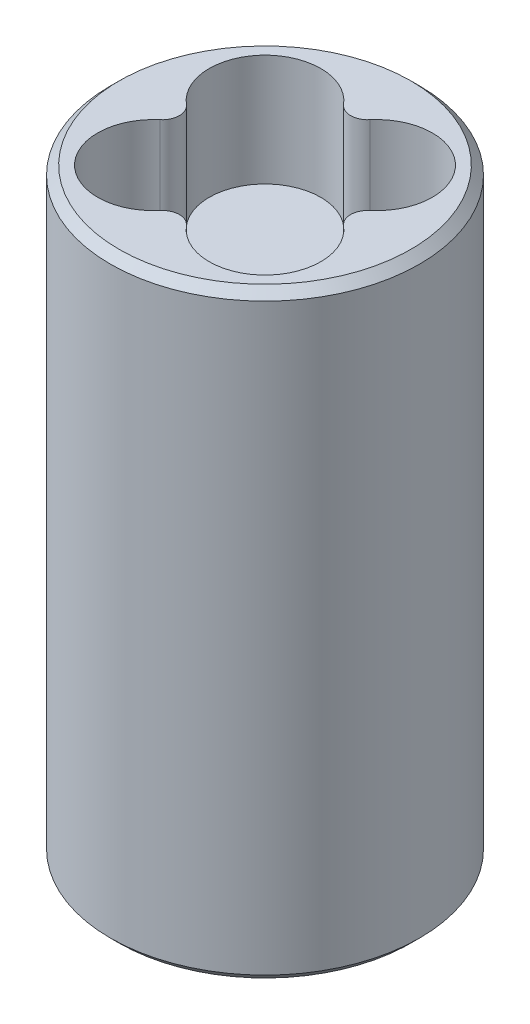
from build123d import *

# Parameters (mm, degrees)
SKETCH3_R           = 9
BOSS_EXTRUDE3_DEPTH = 35
CUT_EXTRUDE1_DEPTH  = 6.5
FILLET1_R           = 1
SKETCH1_R           = 3.05
CUT_EXTRUDE2_DEPTH  = 7
CHAMFER1_SIZE       = 3.05
CHAMFER2_SIZE       = 0.5


with BuildPart() as part:
    # Sketch3 → Boss-Extrude3 (new body)
    with BuildSketch(Plane(origin=(0, 0, 0), x_dir=(1, 0, 0), z_dir=(0, 1, 0))):
        with Locations(Location((0, 0, 0), (0, 0, 270))):
            Circle(SKETCH3_R)
    extrude(amount=BOSS_EXTRUDE3_DEPTH)

    # Sketch4 → Cut-Extrude1 (cut)
    with BuildSketch(Plane(origin=(0, 35, 0), x_dir=(1, 0, 0), z_dir=(0, 1, 0))):
        with BuildLine():
            ThreePointArc((0, -3.25), (5.548097039, -5.548097039), (3.25, 0))
            ThreePointArc((3.25, 0), (5.548097039, 5.548097039), (0, 3.25))
            ThreePointArc((0, 3.25), (-5.548097039, 5.548097039), (-3.25, 0))
            ThreePointArc((-3.25, 0), (-5.548097039, -5.548097039), (0, -3.25))
        make_face()
    extrude(amount=-CUT_EXTRUDE1_DEPTH, mode=Mode.SUBTRACT)

    # Fillet1
    fillet1_edges = [part.edges().sort_by_distance(p)[0] for p in [
        (-3.25, 31.75, 0),
        (0, 31.75, -3.25),
        (3.25, 31.75, 0),
        (0, 31.75, 3.25),
    ]]
    fillet(fillet1_edges, radius=FILLET1_R)

    # Sketch1 → Cut-Extrude2 (cut)
    with BuildSketch(Plane(origin=(0, 0, 0), x_dir=(-1, 0, 0), z_dir=(0, -1, 0))):
        with Locations(Location((0, 0, 0), (0, 0, 90))):
            Circle(SKETCH1_R)
    extrude(amount=-CUT_EXTRUDE2_DEPTH, mode=Mode.SUBTRACT)

    # Chamfer1
    chamfer1_edges = [part.edges().sort_by_distance(p)[0] for p in [
        (0, 7, 3.05),
    ]]
    chamfer(chamfer1_edges, length=CHAMFER1_SIZE)

    # Chamfer2
    chamfer2_edges = [part.edges().sort_by_distance(p)[0] for p in [
        (0, 0, -9),
        (0, 35, -9),
    ]]
    chamfer(chamfer2_edges, length=CHAMFER2_SIZE)


solid = part.part
